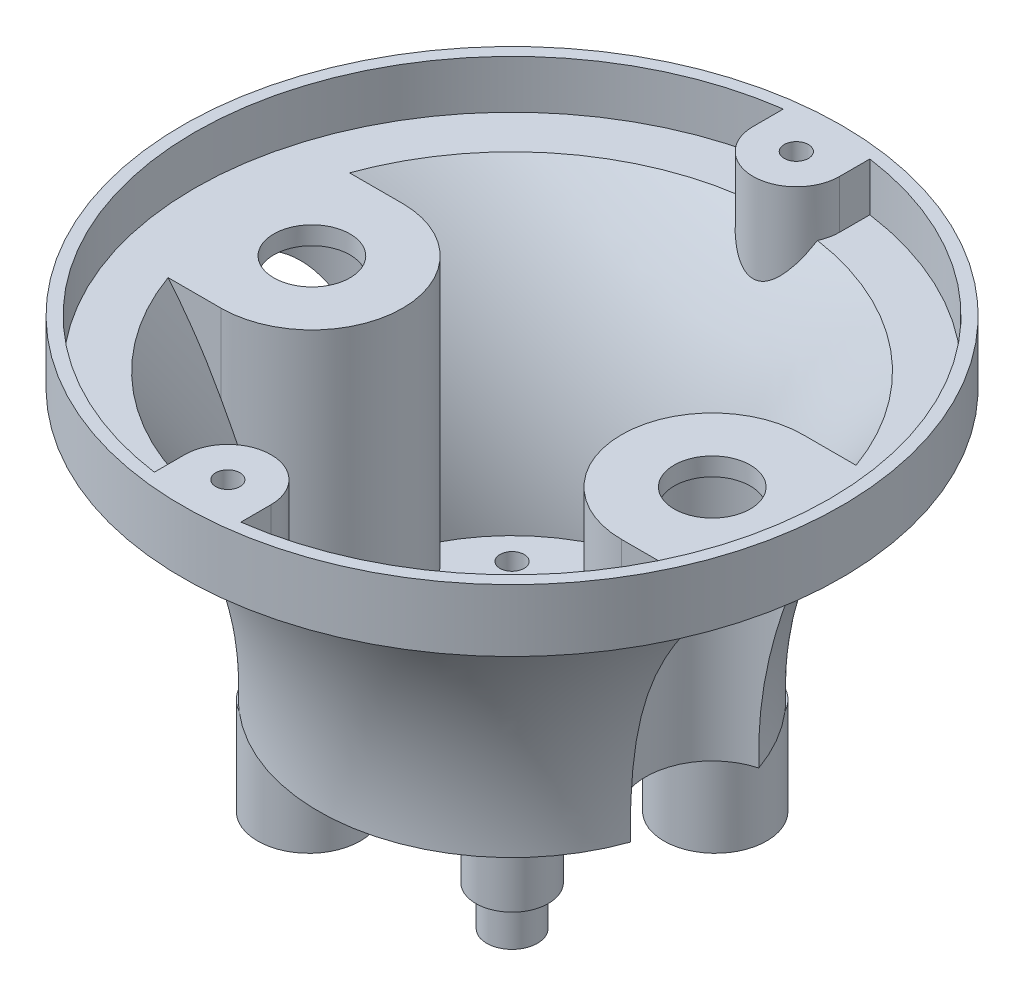
from build123d import *

# Parameters (mm, degrees)
BOSS_EXTRU_1_REACH      = 49.343
ESQUISSE4_R             = 1
BOSS_EXTRU_2_REACH      = 47.137
ESQUISSE5_R             = 3.15
ESQUISSE6_R             = 5.15
ENL_V_MAT_EXTRU_2_DEPTH = 22
ESQUISSE8_R             = 3.15
ENL_V_MAT_EXTRU_3_DEPTH = 46.13729057
ESQUISSE9_R             = 5.5
ENL_V_MAT_EXTRU_5_DEPTH = 22
ESQUISSE10_R            = 4.25
ESQUISSE10_R_2          = 3
BOSS_EXTRU_3_DEPTH      = 8
ESQUISSE11_R            = 1.5
ENL_V_MAT_EXTRU_6_DEPTH = 53.396326275
ESQUISSE12_R            = 1
ENL_V_MAT_EXTRU_7_DEPTH = 53.396326275
ENL_V_START             = -3.3
ESQUISSE13_R            = 3
ESQUISSE13_R_2          = 2.1
ENL_V_MAT_EXTRU_8_DEPTH = 3.3


with BuildPart() as part:
    # Esquisse1 → Révolution1 (revolve)
    with BuildSketch(Plane.XY, mode=Mode.PRIVATE) as r_volution1_sk:
        with BuildLine():
            Line((0, 0), (16, 0))
            ThreePointArc((16, 0), (17.693443908, 11.801567412), (23.25, 22.35))
            Line((23.25, 22.35), (27.25, 22.35))
            Line((27.25, 22.35), (27.25, 27.5))
            Line((27.25, 27.5), (26.25, 27.5))
            Line((26.25, 27.5), (26.25, 23.5))
            Line((26.25, 23.5), (22.243806548, 23.5))
            ThreePointArc((22.243806548, 23.5), (16.561622355, 13.136173942), (14.489048167, 1.5))
            Line((14.489048167, 1.5), (0, 1.5))
            Line((0, 1.5), (0, 0))
        make_face()
    revolve(r_volution1_sk.sketch.rotate(Axis((0, 0, 0), (0, 1, 0)), 90), axis=Axis((0, 0, 0), (0, 1, 0)))

    # Esquisse4 → Boss.-Extru.1 (add, up to next)
    with BuildSketch(Plane(origin=(0, 27.5, 0), x_dir=(1, 0, 0), z_dir=(0, 1, 0)), mode=Mode.PRIVATE) as boss_extru_1_sk1:
        with BuildLine():
            Line((-3.575, 26.005420108), (-3.575, 23.5))
            ThreePointArc((-3.575, 23.5), (0, 19.925), (3.575, 23.5))
            Line((3.575, 23.5), (3.575, 26.005420108))
            ThreePointArc((3.575, 26.005420108), (0, 26.25), (-3.575, 26.005420108))
        make_face()
        with Locations(Location((0, 23.5, 0), (0, 0, 270))):
            Circle(ESQUISSE4_R, mode=Mode.SUBTRACT)
    boss_extru_1_tool1 = extrude(boss_extru_1_sk1.sketch, amount=-BOSS_EXTRU_1_REACH, mode=Mode.PRIVATE) - part.part
    # Esquisse4 → Boss.-Extru.1 (add, up to next)
    with BuildSketch(Plane(origin=(0, 27.5, 0), x_dir=(1, 0, 0), z_dir=(0, 1, 0)), mode=Mode.PRIVATE) as boss_extru_1_sk2:
        with BuildLine():
            Line((-3.575, -23.5), (-3.575, -26.005420108))
            ThreePointArc((-3.575, -26.005420108), (0, -26.25), (3.575, -26.005420108))
            Line((3.575, -26.005420108), (3.575, -23.5))
            ThreePointArc((3.575, -23.5), (0, -19.925), (-3.575, -23.5))
        make_face()
        with Locations(Location((0, -23.5, 0), (0, 0, 270))):
            Circle(ESQUISSE4_R, mode=Mode.SUBTRACT)
    boss_extru_1_tool2 = extrude(boss_extru_1_sk2.sketch, amount=-BOSS_EXTRU_1_REACH, mode=Mode.PRIVATE) - part.part
    add(boss_extru_1_tool1.solids().sort_by_distance((0, 27.5, -26.154539))[0])
    add(boss_extru_1_tool2.solids().sort_by_distance((3.479539, 27.5, 24.75271))[0])

    # Esquisse5 → Boss.-Extru.2 (add, up to next)
    with BuildSketch(Plane(origin=(0, 23.5, 0), x_dir=(1, 0, 0), z_dir=(0, 1, 0)), mode=Mode.PRIVATE) as boss_extru_2_sk1:
        with BuildLine():
            Line((-16.55, 7.5), (-20.941273355, 7.5))
            ThreePointArc((-20.941273355, 7.5), (-22.243806548, 0), (-20.941273355, -7.5))
            Line((-20.941273355, -7.5), (-16.55, -7.5))
            ThreePointArc((-16.55, -7.5), (-9.05, 0), (-16.55, 7.5))
        make_face()
        with Locations(Location((-16.55, 0, 0), (0, 0, 270))):
            Circle(ESQUISSE5_R, mode=Mode.SUBTRACT)
    boss_extru_2_tool1 = extrude(boss_extru_2_sk1.sketch, amount=-BOSS_EXTRU_2_REACH, mode=Mode.PRIVATE) - part.part
    # Esquisse5 → Boss.-Extru.2 (add, up to next)
    with BuildSketch(Plane(origin=(0, 23.5, 0), x_dir=(1, 0, 0), z_dir=(0, 1, 0)), mode=Mode.PRIVATE) as boss_extru_2_sk2:
        with BuildLine():
            Line((16.55, -7.5), (20.941273355, -7.5))
            ThreePointArc((20.941273355, -7.5), (22.243806548, 0), (20.941273355, 7.5))
            Line((20.941273355, 7.5), (16.55, 7.5))
            ThreePointArc((16.55, 7.5), (9.05, 0), (16.55, -7.5))
        make_face()
        with Locations(Location((16.55, 0, 0), (0, 0, 224.870853296))):
            Circle(ESQUISSE5_R, mode=Mode.SUBTRACT)
    boss_extru_2_tool2 = extrude(boss_extru_2_sk2.sketch, amount=-BOSS_EXTRU_2_REACH, mode=Mode.PRIVATE) - part.part
    add(boss_extru_2_tool1.solids().sort_by_distance((-18.745637, 23.5, -7.300231))[0])
    add(boss_extru_2_tool2.solids().sort_by_distance((18.745637, 23.5, 7.300231))[0])

    # Esquisse6 → Enlèv. mat.-Extru.2 (cut)
    with BuildSketch(Plane.XZ):
        with Locations(Location((0, 0, 0), (0, 0, 270))):
            Circle(ESQUISSE6_R)
    extrude(amount=-ENL_V_MAT_EXTRU_2_DEPTH, mode=Mode.SUBTRACT)

    # Esquisse8 → Enlèv. mat.-Extru.3 (cut, through all)
    with BuildSketch(Plane(origin=(0, 23.5, 0), x_dir=(1, 0, 0), z_dir=(0, 1, 0))):
        with Locations(Location((-16.55, 0, 0), (0, 0, 270))):
            Circle(ESQUISSE8_R)
        with Locations(Location((16.55, 0, 0), (0, 0, 254.52201619))):
            Circle(ESQUISSE8_R)
    extrude(amount=-ENL_V_MAT_EXTRU_3_DEPTH, mode=Mode.SUBTRACT)

    # Esquisse9 → Enlèv. mat.-Extru.5 (cut)
    with BuildSketch(Plane(origin=(0, 0, 0), x_dir=(-1, 0, 0), z_dir=(0, -1, 0))):
        with Locations(Location((16.55, 0, 0), (0, 0, 90))):
            Circle(ESQUISSE9_R)
        with Locations(Location((-16.55, 0, 0), (0, 0, 74.662665416))):
            Circle(ESQUISSE9_R)
    extrude(amount=-ENL_V_MAT_EXTRU_5_DEPTH, mode=Mode.SUBTRACT)

    # Esquisse10 → Boss.-Extru.3 (add)
    with BuildSketch(Plane.XZ):
        with Locations(Location((-8.396893027, 8.396893027, 0), (0, 0, 118.784200872))):
            Circle(ESQUISSE10_R)
        with Locations(Location((8.40042856, 8.40042856, 0), (0, 0, 270))):
            Circle(ESQUISSE10_R_2)
        with Locations(Location((8.40042856, -8.40042856, 0), (0, 0, 90))):
            Circle(ESQUISSE10_R)
        with Locations(Location((-8.396893027, -8.396893027, 0), (0, 0, 270))):
            Circle(ESQUISSE10_R_2)
    extrude(amount=BOSS_EXTRU_3_DEPTH)

    # Esquisse11 → Enlèv. mat.-Extru.6 (cut, through all)
    with BuildSketch(Plane.XZ.offset(8)):
        with Locations(Location((-8.396893027, 8.396893027, 0), (0, 0, 270))):
            Circle(ESQUISSE11_R)
        with Locations(Location((8.40042856, -8.40042856, 0), (0, 0, 270))):
            Circle(ESQUISSE11_R)
    extrude(amount=-ENL_V_MAT_EXTRU_6_DEPTH, mode=Mode.SUBTRACT)

    # Esquisse12 → Enlèv. mat.-Extru.7 (cut, through all)
    with BuildSketch(Plane.XZ.offset(8)):
        with Locations(Location((-8.396893027, -8.396893027, 0), (0, 0, 270))):
            Circle(ESQUISSE12_R)
        with Locations(Location((8.40042856, 8.40042856, 0), (0, 0, 270))):
            Circle(ESQUISSE12_R)
    extrude(amount=-ENL_V_MAT_EXTRU_7_DEPTH, mode=Mode.SUBTRACT)

    # Esquisse13 → Enlèv. mat.-Extru.8 (cut)
    # profile 1 of 2: a face of its own
    with BuildSketch(Plane.XZ.offset(8).offset(ENL_V_START)):
        with Locations(Location((-8.396893027, -8.396893027, 0), (0, 0, 270))):
            Circle(ESQUISSE13_R)
        with Locations(Location((-8.396893027, -8.396893027, 0), (0, 0, 270))):
            Circle(ESQUISSE13_R_2, mode=Mode.SUBTRACT)
    # profile 2 of 2: a face of its own
    with BuildSketch(Plane.XZ.offset(8).offset(ENL_V_START)):
        with Locations(Location((8.40042856, 8.40042856, 0), (0, 0, 270))):
            Circle(ESQUISSE13_R)
        with Locations(Location((8.40042856, 8.40042856, 0), (0, 0, 270))):
            Circle(ESQUISSE13_R_2, mode=Mode.SUBTRACT)
    extrude(amount=ENL_V_MAT_EXTRU_8_DEPTH, mode=Mode.SUBTRACT)


solid = part.part
